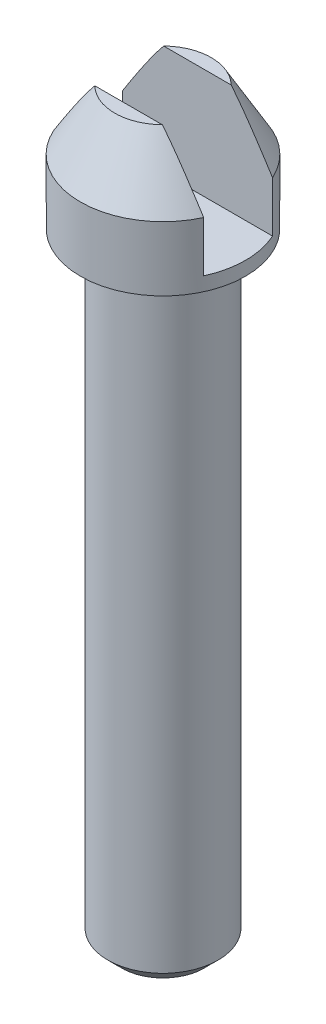
from build123d import *

# Parameters (mm, degrees)
SKIZZE2_W                       = 14
SKIZZE2_H                       = 5
SCHNITT_LINEAR_AUSTRAGEN1_DEPTH = 8
FASE1_SIZE                      = 1


with BuildPart() as part:
    # Skizze1 → Rotation1 (revolve)
    with BuildSketch(Plane.XY, mode=Mode.PRIVATE) as rotation1_sk:
        Polygon((0, 0), (0, 54), (-3.5, 54), (-6, 49.669872981), (-6, 45), (-4, 45), (-4, 0), align=None)
    revolve(rotation1_sk.sketch.rotate(Axis((0, 0, 0), (0, -1, 0)), 270), axis=Axis((0, 0, 0), (0, -1, 0)))

    # Skizze2 → Schnitt-Linear austragen1 (cut)
    with BuildSketch(Plane(origin=(0, 54, 0), x_dir=(1, 0, 0), z_dir=(0, 1, 0))):
        Rectangle(SKIZZE2_W, SKIZZE2_H)
    extrude(amount=-SCHNITT_LINEAR_AUSTRAGEN1_DEPTH, mode=Mode.SUBTRACT)

    # Fase1
    fase1_edges = [part.edges().sort_by_distance(p)[0] for p in [
        (0, 0, -4),
    ]]
    chamfer(fase1_edges, length=FASE1_SIZE)


solid = part.part
